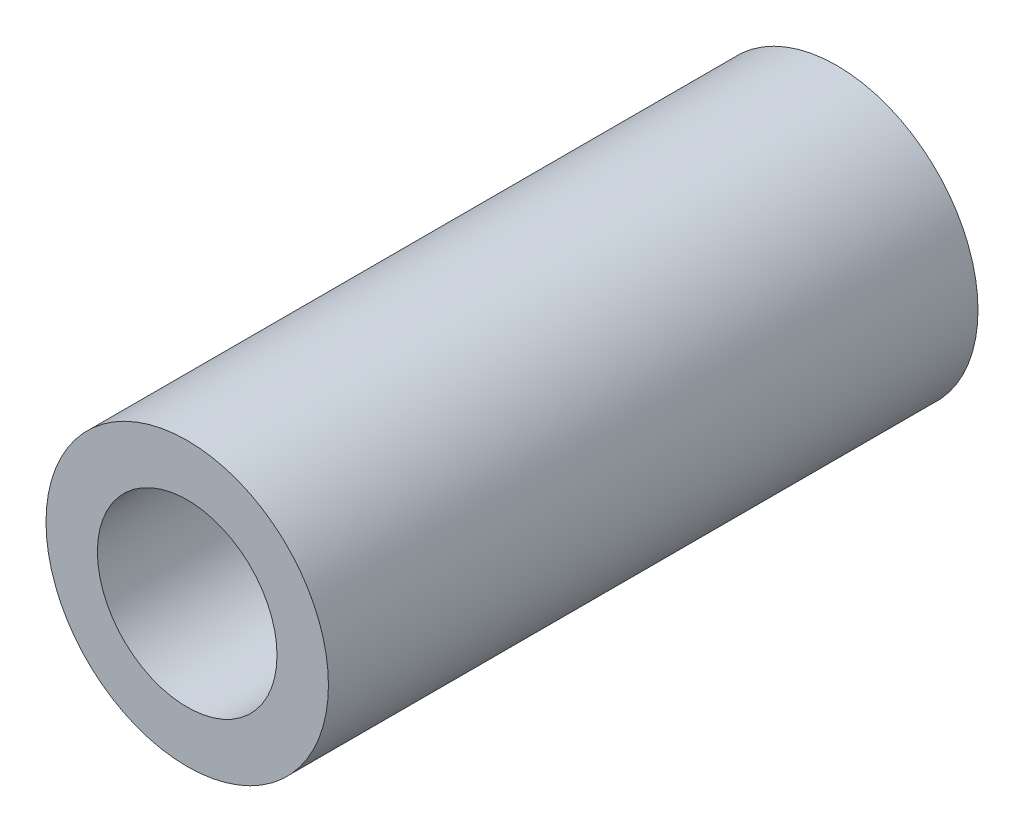
from build123d import *

# Parameters (mm, degrees)
SKETCH1_R           = 25
SKETCH1_R_2         = 15.9
BOSS_EXTRUDE1_DEPTH = 115


with BuildPart() as part:
    # Sketch1 → Boss-Extrude1 (new body)
    with BuildSketch(Plane.XY):
        Circle(SKETCH1_R)
        Circle(SKETCH1_R_2, mode=Mode.SUBTRACT)
    extrude(amount=BOSS_EXTRUDE1_DEPTH)


solid = part.part
